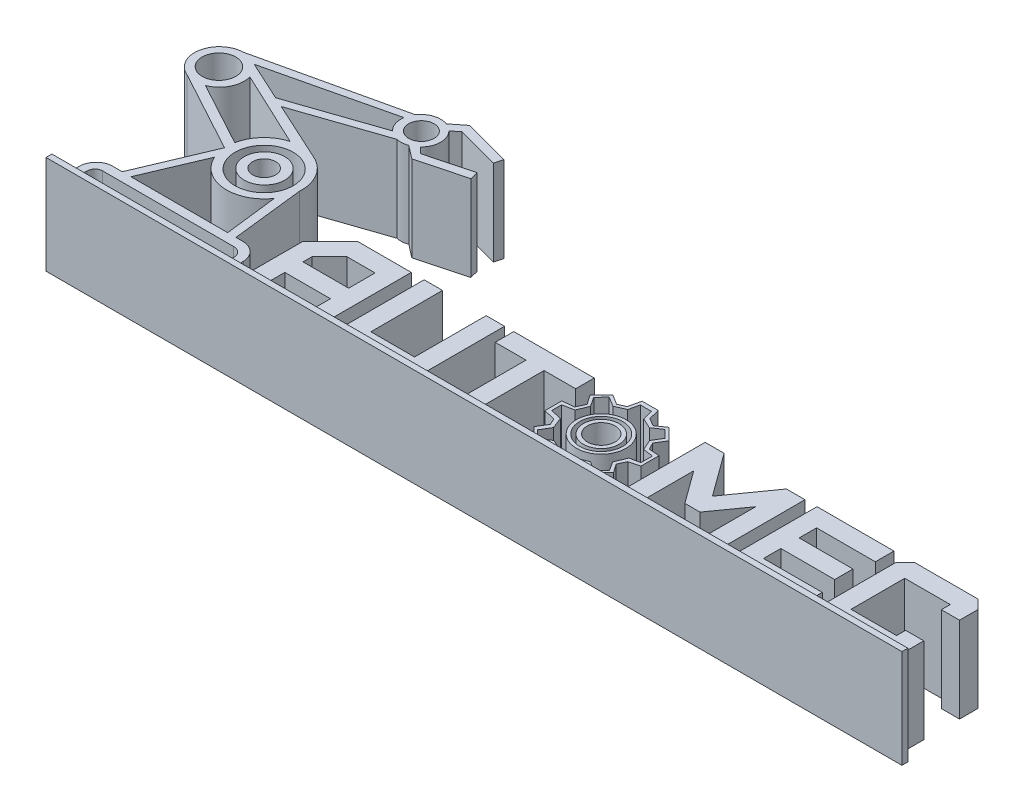
from build123d import *

# Parameters (mm, degrees)
SKETCH1_R              = 19.638478863
SKETCH1_R_2            = 14.841134558
SKETCH1_R_3            = 33.945181935
BOSS_EXTRUDE3_DEPTH    = 20
BOSS_EXTRUDE3_2_DEPTH  = 20
BOSS_EXTRUDE3_3_DEPTH  = 20
BOSS_EXTRUDE3_4_DEPTH  = 20
BOSS_EXTRUDE3_5_DEPTH  = 20
BOSS_EXTRUDE3_6_DEPTH  = 20
BOSS_EXTRUDE3_7_DEPTH  = 20
BOSS_EXTRUDE3_8_DEPTH  = 20
SKETCH1_R_4            = 23.705875318
SKETCH1_R_5            = 13.441561648
BOSS_EXTRUDE3_9_DEPTH  = 20
SKETCH1_R_6            = 28.936539224
SKETCH1_R_7            = 25.172875838
BOSS_EXTRUDE3_10_DEPTH = 20
SKETCH1_R_8            = 20.860639354
SKETCH1_R_9            = 16.254652286
BOSS_EXTRUDE3_11_DEPTH = 20
BOSS_EXTRUDE4_DEPTH    = 23
BOSS_EXTRUDE5_DEPTH    = 5
SCALE2_SCALE_X         = 0.2
SCALE2_SCALE_Y         = 1
SCALE2_SCALE_Z         = 0.2


with BuildPart() as part:
    # Sketch1 → Boss-Extrude3 (new body)
    with BuildSketch(Plane(origin=(0, 0, 0), x_dir=(1, 0, 0), z_dir=(0, 1, 0))):
        with BuildLine():
            Line((143.142771274, 268.551222923), (-20.066683919, 231.448561929))
            ThreePointArc((-20.066683919, 231.448561929), (-48.08274217, 207.697002969), (-30.2767921, 175.572491843))
            Line((-30.2767921, 175.572491843), (65.13223045, 123.762206868))
            Line((65.13223045, 123.762206868), (29.665610075, 39.838888731))
            Line((29.665610075, 39.838888731), (17.427719175, 39.838888731))
            ThreePointArc((17.427719175, 39.838888731), (4.37706487, 33.661602398), (-0.92807644, 20.232755838))
            Line((-0.92807644, 20.232755838), (-0.92807644, 6.699341433))
            ThreePointArc((-0.92807644, 6.699341433), (1.439006355, 3.093293076), (5.519838836, 1.695626459))
            Line((5.519838836, 1.695626459), (187.056420311, 1.695626459))
            ThreePointArc((187.056420311, 1.695626459), (189.890342969, 3.516284124), (190.99218603, 6.699341433))
            Line((190.99218603, 6.699341433), (190.99218603, 20.232755838))
            ThreePointArc((190.99218603, 20.232755838), (184.584997904, 34.156147144), (170.350556109, 39.838888731))
            Line((170.350556109, 39.838888731), (162.419916837, 39.838888731))
            Line((162.419916837, 39.838888731), (152.794511162, 123.762206868))
            ThreePointArc((152.794511162, 123.762206868), (145.984902768, 149.800684723), (125.259763461, 166.97163974))
            Line((125.259763461, 166.97163974), (56.575915473, 198.553079106))
            Line((56.575915473, 198.553079106), (157.148813199, 232.909520835))
            ThreePointArc((157.148813199, 232.909520835), (163.806970263, 232.345523476), (170.350556109, 233.698532264))
            Line((170.350556109, 233.698532264), (185.669513374, 221.850702315))
            Line((185.669513374, 221.850702315), (240.175788961, 236.31824449))
            Line((240.175788961, 236.31824449), (237.60073395, 246.019730503))
            Line((237.60073395, 246.019730503), (185.669513374, 232.235682413))
            Line((185.669513374, 232.235682413), (178.835688766, 239.089620535))
            ThreePointArc((178.835688766, 239.089620535), (185.666823394, 255.200048889), (179.328917733, 271.510819989))
            Line((179.328917733, 271.510819989), (187.056420311, 278.803304387))
            Line((187.056420311, 278.803304387), (237.60073395, 265.195725475))
            Line((237.60073395, 265.195725475), (240.175788961, 274.76057084))
            Line((240.175788961, 274.76057084), (185.669513374, 289.434792188))
            Line((185.669513374, 289.434792188), (170.350556109, 277.408883435))
            ThreePointArc((170.350556109, 277.408883435), (155.222671622, 277.661249559), (143.142771274, 268.551222923))
        make_face()
        with BuildLine():
            Line((65.938427209, 134.92750663), (-8.909613341, 175.572491843))
            ThreePointArc((-8.909613341, 175.572491843), (6.333753594, 189.585847209), (8.324402462, 210.195837049))
            Line((8.324402462, 210.195837049), (97.055580754, 168.462639817))
            ThreePointArc((97.055580754, 168.462639817), (76.78336776, 156.068842703), (65.938427209, 134.92750663))
        make_face(mode=Mode.SUBTRACT)
        with BuildLine():
            Line((44.470389253, 204.119306881), (-1.969110638, 225.472598709))
            Line((-1.969110638, 225.472598709), (139.423502901, 258.97550346))
            ThreePointArc((139.423502901, 258.97550346), (140.395436733, 248.10615689), (146.219590259, 238.877582463))
            Line((146.219590259, 238.877582463), (44.470389253, 204.119306881))
        make_face(mode=Mode.SUBTRACT)
        with Locations(Location((-20.066683919, 202.485175867, 0), (0, 0, 270))):
            Circle(SKETCH1_R, mode=Mode.SUBTRACT)
        with Locations(Location((163.173974101, 255.540121232, 0), (0, 0, 270))):
            Circle(SKETCH1_R_2, mode=Mode.SUBTRACT)
        with Locations(Location((109.737807996, 125.434673325, 0), (0, 0, 270))):
            Circle(SKETCH1_R_3, mode=Mode.SUBTRACT)
        with BuildLine():
            ThreePointArc((68.82897061, 108.421864432), (105.123555566, 82.477977197), (145.3839321, 101.699950647))
            Line((145.3839321, 101.699950647), (152.794511162, 39.838888731))
            Line((152.794511162, 39.838888731), (39.756094219, 39.838888731))
            Line((39.756094219, 39.838888731), (68.82897061, 108.421864432))
        make_face(mode=Mode.SUBTRACT)
        with BuildLine():
            ThreePointArc((170.350556109, 29.251217986), (177.471060726, 26.709270346), (181.372066191, 20.232755838))
            Line((181.372066191, 20.232755838), (181.372066191, 10.7136894))
            Line((181.372066191, 10.7136894), (8.324402462, 10.7136894))
            Line((8.324402462, 10.7136894), (8.324402462, 20.232755838))
            ThreePointArc((8.324402462, 20.232755838), (10.96584887, 26.609771579), (17.34286461, 29.251217986))
            Line((17.34286461, 29.251217986), (170.350556109, 29.251217986))
        make_face(mode=Mode.SUBTRACT)
    extrude(amount=BOSS_EXTRUDE3_DEPTH)



with BuildPart() as body_2:
    # Sketch1 → Boss-Extrude3 2 (new body)
    with BuildSketch(Plane(origin=(0, 0, 0), x_dir=(1, 0, 0), z_dir=(0, 1, 0))):
        Polygon((205.524825841, 74.70012702), (205.524825841, 1.695626459), (226.323997377, 1.695626459), (226.323997377, 32.972523229), (279.551984747, 32.972523229), (279.551984747, 1.695626459), (300.127509276, 1.695626459), (300.127509276, 106.776035129), (237.60073395, 106.776035129), align=None)
        Polygon((279.551984747, 54.235830794), (226.323997377, 54.235830794), (226.323997377, 64.730398046), (246.6758749, 85.08227557), (279.551984747, 85.08227557), align=None, mode=Mode.SUBTRACT)
    extrude(amount=BOSS_EXTRUDE3_2_DEPTH)


with BuildPart() as body_3:
    # Sketch1 → Boss-Extrude3 3 (new body)
    with BuildSketch(Plane(origin=(0, 0, 0), x_dir=(1, 0, 0), z_dir=(0, 1, 0))):
        Polygon((886.728702325, 1.695626459), (961.16194012, 1.695626459), (971.701040984, 12.234727322), (971.701040984, 33.464350851), (950.471417455, 33.464350851), (950.471417455, 22.849539087), (897.34351409, 22.849539087), (897.34351409, 85.574103193), (950.471417455, 85.574103193), (950.471417455, 75.191954642), (971.701040984, 75.191954642), (971.701040984, 96.728761888), (961.086229219, 107.343573652), (886.728702325, 107.267862751), (876.189601462, 96.728761888), (876.189601462, 12.234727322), align=None)
    extrude(amount=BOSS_EXTRUDE3_3_DEPTH)


with BuildPart() as body_4:
    # Sketch1 → Boss-Extrude3 4 (new body)
    with BuildSketch(Plane(origin=(0, 0, 0), x_dir=(1, 0, 0), z_dir=(0, 1, 0))):
        Polygon((315.111858662, 10.7136894), (324.129921603, 1.695626459), (398.979485821, 1.695626459), (409.026759062, 11.7428997), (409.026759062, 106.776035129), (387.573488527, 106.776035129), (387.573488527, 23.148896994), (336.565129197, 23.148896994), (336.565129197, 106.776035129), (315.111858662, 106.776035129), align=None)
    extrude(amount=BOSS_EXTRUDE3_4_DEPTH)


with BuildPart() as body_5:
    # Sketch1 → Boss-Extrude3 5 (new body)
    with BuildSketch(Plane(origin=(0, 0, 0), x_dir=(1, 0, 0), z_dir=(0, 1, 0))):
        Polygon((773.755843894, 1.695626459), (863.525068241, 1.695626459), (863.525068241, 23.148896994), (794.917323579, 23.148896994), (794.917323579, 43.388951015), (857.73350538, 43.388951015), (857.73350538, 64.730398046), (794.917323579, 64.730398046), (794.917323579, 85.08227557), (863.525068241, 85.08227557), (863.525068241, 106.776035129), (773.755843894, 106.776035129), align=None)
    extrude(amount=BOSS_EXTRUDE3_5_DEPTH)


with BuildPart() as body_6:
    # Sketch1 → Boss-Extrude3 6 (new body)
    with BuildSketch(Plane(origin=(0, 0, 0), x_dir=(1, 0, 0), z_dir=(0, 1, 0))):
        Polygon((455.785825283, 85.08227557), (455.785825283, 1.695626459), (476.808643824, 1.695626459), (476.808643824, 85.08227557), (513.710399774, 85.08227557), (513.710399774, 106.776035129), (419.778657356, 106.776035129), (419.778657356, 85.08227557), align=None)
    extrude(amount=BOSS_EXTRUDE3_6_DEPTH)


with BuildPart() as body_7:
    # Sketch1 → Boss-Extrude3 7 (new body)
    with BuildSketch(Plane(origin=(0, 0, 0), x_dir=(1, 0, 0), z_dir=(0, 1, 0))):
        Polygon((738.028346548, 1.695626459), (759.722106106, 1.695626459), (759.722106106, 106.776035128), (738.028346548, 106.776035128), (702.133002124, 56.344559491), (665.566716683, 106.475757274), (643.425663113, 106.475757274), (643.425663113, 1.695626459), (665.566716683, 1.695626459), (665.566716683, 70.992514207), (693.298945397, 32.972523229), (710.967058851, 32.972523229), (738.028346548, 70.992514207), align=None)
    extrude(amount=BOSS_EXTRUDE3_7_DEPTH)


with BuildPart() as body_8:
    # Sketch1 → Boss-Extrude3 8 (new body)
    with BuildSketch(Plane(origin=(0, 0, 0), x_dir=(1, 0, 0), z_dir=(0, 1, 0))):
        Polygon((561.811156285, 11.022132391), (564.206833782, 1.695626459), (584.548916634, 1.695626459), (587.139669167, 13.048376699), (596.077110393, 15.344116066), (607.08101677, 8.714733796), (620.584288241, 22.351755897), (613.542887133, 32.620988551), (617.886588615, 41.869512454), (629.982213547, 44.976486993), (629.982213547, 66.07345155), (617.886588615, 66.967470506), (613.542887133, 75.129982664), (620.710099352, 87.026616321), (607.08101677, 100.448493701), (596.077110393, 92.903341968), (587.139669167, 98.287767497), (583.786023452, 111.343697056), (565.065547238, 111.343697056), (561.811156285, 97.082864651), (553.182677099, 93.315612167), (541.853221859, 100.448493701), (528.56298499, 87.026616321), (536.144263058, 75.970023025), (531.496196769, 66.07345155), (517.881347226, 64.708779488), (517.881347226, 44.976486993), (531.496196769, 41.869512454), (534.830790982, 34.231989649), (527.62577602, 22.272608391), (541.287700266, 8.744679012), (553.182677099, 15.074621006), align=None)
        Polygon((540.060260784, 75.991641583), (532.888416484, 87.04823488), (541.853221859, 96.101837134), (553.182677099, 89.276325618), (565.065547238, 94.464467245), (567.806581737, 106.475757274), (580.70071182, 106.475757274), (583.786023452, 94.464467245), (596.077110393, 88.691782532), (607.08101677, 96.236934265), (615.924941998, 87.04823488), (609.263818115, 75.991641583), (614.808785716, 63.291500634), (626.508975948, 61.946779828), (626.508975948, 48.502177727), (614.808785716, 46.108956998), (609.263818115, 32.642607109), (615.924941998, 22.373374455), (607.08101677, 13.224486288), (596.077110393, 19.989186093), (583.764503353, 15.08767265), (581.488576126, 5.202505812), (567.089265505, 5.202505812), (565.065547238, 15.096239565), (553.182677099, 19.989186093), (541.853221859, 12.640350262), (532.888416484, 21.306328792), (540.060260784, 32.972523229), (534.830790982, 46.108956998), (521.682409764, 49.136195616), (521.682409764, 60.602059022), (534.830790982, 63.291500634), align=None, mode=Mode.SUBTRACT)
    extrude(amount=BOSS_EXTRUDE3_8_DEPTH)


with BuildPart() as body_9:
    # Sketch1 → Boss-Extrude3 9 (new body)
    with BuildSketch(Plane(origin=(0, 0, 0), x_dir=(1, 0, 0), z_dir=(0, 1, 0))):
        with Locations(Location((109.350589401, 126.209110515, 0), (0, 0, 270))):
            Circle(SKETCH1_R_4)
        with Locations(Location((108.963370806, 126.209110515, 0), (0, 0, 270))):
            Circle(SKETCH1_R_5, mode=Mode.SUBTRACT)
    extrude(amount=BOSS_EXTRUDE3_9_DEPTH)


with BuildPart() as body_10:
    # Sketch1 → Boss-Extrude3 10 (new body)
    with BuildSketch(Plane(origin=(0, 0, 0), x_dir=(1, 0, 0), z_dir=(0, 1, 0))):
        with Locations(Location((574.321184091, 54.290961869, 0), (0, 0, 270))):
            Circle(SKETCH1_R_6)
        with Locations(Location((574.321184091, 54.290961869, 0), (0, 0, 270))):
            Circle(SKETCH1_R_7, mode=Mode.SUBTRACT)
    extrude(amount=BOSS_EXTRUDE3_10_DEPTH)


with BuildPart() as body_11:
    # Sketch1 → Boss-Extrude3 11 (new body)
    with BuildSketch(Plane(origin=(0, 0, 0), x_dir=(1, 0, 0), z_dir=(0, 1, 0))):
        with Locations(Location((574.321184091, 54.290961869, 0), (0, 0, 270))):
            Circle(SKETCH1_R_8)
        with Locations(Location((574.321184091, 54.290961869, 0), (0, 0, 270))):
            Circle(SKETCH1_R_9, mode=Mode.SUBTRACT)
    extrude(amount=BOSS_EXTRUDE3_11_DEPTH)


with BuildPart() as part_1:
    add(part.part)

    add(body_2.part)  # Boss-Extrude4 merges body 2

    add(body_3.part)  # Boss-Extrude4 merges body 3

    add(body_4.part)  # Boss-Extrude4 merges body 4

    add(body_5.part)  # Boss-Extrude4 merges body 5

    add(body_6.part)  # Boss-Extrude4 merges body 6

    add(body_7.part)  # Boss-Extrude4 merges body 7

    add(body_8.part)  # Boss-Extrude4 merges body 8
    # Sketch1<9> → Boss-Extrude4 (add)
    with BuildSketch(Plane(origin=(0, 0, 0), x_dir=(1, 0, 0), z_dir=(0, 1, 0))):
        Polygon((187.056420311, 1.695626459), (5.519838836, 1.695626459), (-14.265268254, 1.695626459), (-14.265268254, -5.210883228), (984.802454964, -5.210883228), (984.802454964, 1.695626459), (961.16194012, 1.695626459), (886.728702325, 1.695626459), (863.525068241, 1.695626459), (773.755843894, 1.695626459), (759.722106106, 1.695626459), (738.028346548, 1.695626459), (665.566716683, 1.695626459), (643.425663113, 1.695626459), (584.548916634, 1.695626459), (564.206833782, 1.695626459), (476.808643824, 1.695626459), (455.785825283, 1.695626459), (398.979485821, 1.695626459), (324.129921603, 1.695626459), (300.127509276, 1.695626459), (279.551984747, 1.695626459), (226.323997377, 1.695626459), (205.524825841, 1.695626459), align=None)
    extrude(amount=BOSS_EXTRUDE4_DEPTH)


    add(body_9.part)  # Boss-Extrude5 merges body 9

    add(body_10.part)  # Boss-Extrude5 merges body 10

    add(body_11.part)  # Boss-Extrude5 merges body 11
    # Sketch1<10> → Boss-Extrude5 (add)
    with BuildSketch(Plane(origin=(0, 0, 0), x_dir=(1, 0, 0), z_dir=(0, 1, 0))):
        with BuildLine():
            ThreePointArc((103.233143824, 92.118540288), (109.344143117, 91.491774148), (115.468034979, 91.976641774))
            Line((115.468034979, 91.976641774), (115.468034979, 103.306154719))
            ThreePointArc((115.468034979, 103.306154719), (109.350589401, 102.503235198), (103.233143824, 103.306154719))
            Line((103.233143824, 103.306154719), (103.233143824, 92.118540288))
        make_face()
        with BuildLine():
            Line((572.271094043, 25.427136186), (572.271094043, 5.202505812))
            Line((572.271094043, 5.202505812), (576.310117778, 5.202505812))
            Line((576.310117778, 5.202505812), (576.310117778, 25.422857583))
            ThreePointArc((576.310117778, 25.422857583), (574.290531167, 25.35443888), (572.271094043, 25.427136186))
        make_face()
        with BuildLine():
            Line((572.271094043, 33.531303753), (572.271094043, 29.20170503))
            ThreePointArc((572.271094043, 29.20170503), (574.29050703, 29.118104724), (576.310117778, 29.196782848))
            Line((576.310117778, 29.196782848), (576.310117778, 33.525355279))
            ThreePointArc((576.310117778, 33.525355279), (574.290461604, 33.430345138), (572.271094043, 33.531303753))
        make_face()
    extrude(amount=BOSS_EXTRUDE5_DEPTH)


with BuildPart() as part_2:
    # Scale2: scaled about (443.261453977, 10.181888651, -72.715621239)
    add(part_1.part.scale((SCALE2_SCALE_X, SCALE2_SCALE_Y, SCALE2_SCALE_Z), about=(443.261453977, 10.181888651, -72.715621239)))


solid = part_2.part
